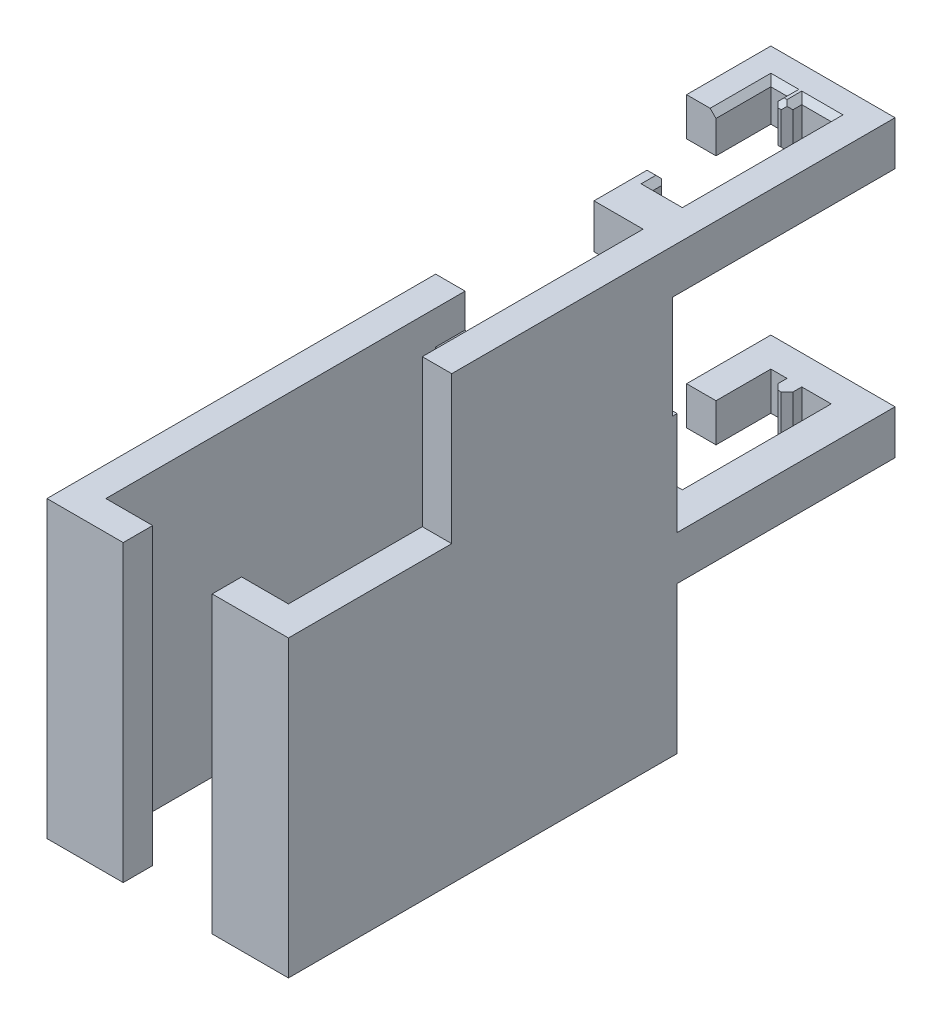
from build123d import *

# Parameters (mm, degrees)
SKETCH1_W               = 16.4
SKETCH1_H               = 26.4
SKETCH1_W_2             = 12.4
SKETCH1_H_2             = 22.4
BOSS_EXTRUDE1_DEPTH     = 20
CUT_EXTRUDE1_DEPTH      = 10
BOSS_EXTRUDE2_DEPTH     = 3
CHAMFER3_SIZE           = 0.4
SKETCH5_W               = 2
SKETCH5_H               = 14.997550085
BOSS_EXTRUDE3_DEPTH     = 10
LPATTERN1_COUNT         = 2
LPATTERN1_PITCH         = 17
CHAMFER1_SIZE           = 0.4
CHAMFER5_SIZE           = 0.4
CHAMFER6_SIZE           = 0.4
CUT_EXTRUDE2_DEPTH      = 47.301249176
CUT_EXTRUDE2_DEPTH_BACK = 47.301249176
SKETCH6_W               = 6.042108652
SKETCH6_H               = 2


with BuildPart() as part:
    # Sketch1 → Boss-Extrude1 (new body)
    with BuildSketch(Plane(origin=(0, 0, 0), x_dir=(1, 0, 0), z_dir=(0, 1, 0))):
        with Locations((6.2, 11.2)):
            Rectangle(SKETCH1_W, SKETCH1_H)
        with Locations((6.2, 11.2)):
            Rectangle(SKETCH1_W_2, SKETCH1_H_2, mode=Mode.SUBTRACT)
    extrude(amount=BOSS_EXTRUDE1_DEPTH)

    # Sketch2 → Cut-Extrude1 (cut)
    with BuildSketch(Plane(origin=(0, 0, -24.4), x_dir=(-1, 0, 0), z_dir=(0, 0, -1))):
        Polygon((-12.4, 20), (-12.4, 17.712061235), (-10.544532553, 15.856593788), (-9.258136531, 15.293507674), (-9.258136531, 13.764128217), (-8.084426715, 12.5904184), (-6.2, 11.765560038), (-4.315573285, 12.5904184), (-3.141863469, 13.764128217), (-3.141863469, 15.293507674), (-1.855467447, 15.856593788), (0, 17.712061235), (0, 20), align=None)
    extrude(amount=-CUT_EXTRUDE1_DEPTH, mode=Mode.SUBTRACT)



with BuildPart() as body_2:
    # Sketch4 → Boss-Extrude2 (new body)
    with BuildSketch(Plane(origin=(0, 30, 0), x_dir=(1, 0, 0), z_dir=(0, 1, 0))):
        Polygon((12.4, 12.2), (14.4, 12.2), (14.4, 39.19752129), (12.472658245, 39.19752129), (7.96501827, 39.19752129), (5.96501827, 39.19752129), (5.96501827, 33.473580557), (7.96501827, 33.473580557), (7.96501827, 37.19752129), (9.06501827, 37.19752129), (9.06501827, 36.19752129), (10.06501827, 36.19752129), (10.06501827, 37.19752129), (12.06501827, 37.19752129), (12.06501827, 27.08752129), (10.06501827, 27.08752129), (10.06501827, 28.08752129), (9.06501827, 28.08752129), (9.06501827, 24.08752129), (12.4, 24.08752129), align=None)
    boss_extrude2 = extrude(amount=-BOSS_EXTRUDE2_DEPTH)

    # Chamfer3
    chamfer3_edges = [body_2.edges().sort_by_distance(p)[0] for p in [
        (6.96501827, 27, -33.473580557),
        (7.96501827, 27, -35.335550923),
        (8.51501827, 27, -37.19752129),
        (9.06501827, 27, -36.69752129),
        (9.56501827, 27, -36.19752129),
        (10.06501827, 27, -36.69752129),
        (11.06501827, 27, -37.19752129),
        (9.56501827, 27, -28.08752129),
        (10.06501827, 27, -27.58752129),
        (11.06501827, 27, -27.08752129),
        (12.06501827, 27, -32.14252129),
    ]]
    chamfer(chamfer3_edges, length=CHAMFER3_SIZE)


with BuildPart() as part_1:
    add(part.part)

    add(body_2.part)  # Boss-Extrude3 merges body 2
    # Sketch5 → Boss-Extrude3 (add)
    with BuildSketch(Plane(origin=(0, 30, 0), x_dir=(1, 0, 0), z_dir=(0, 1, 0))):
        with Locations((13.4, 16.588746248)):
            Rectangle(SKETCH5_W, SKETCH5_H)
    extrude(amount=-BOSS_EXTRUDE3_DEPTH)

    # LPattern1: Boss-Extrude2 ×2
    with Locations(*[(0, -i * LPATTERN1_PITCH, 0) for i in range(1, LPATTERN1_COUNT)]):
        add(boss_extrude2)

    # Chamfer1
    chamfer1_edges = [part_1.edges().sort_by_distance(p)[0] for p in [
        (9.56501827, 30, -28.08752129),
        (10.06501827, 30, -27.58752129),
        (7.96501827, 30, -35.335550923),
        (8.51501827, 30, -37.19752129),
        (9.06501827, 30, -36.69752129),
        (9.56501827, 30, -36.19752129),
        (10.06501827, 30, -36.69752129),
        (11.06501827, 30, -27.08752129),
        (11.06501827, 30, -37.19752129),
        (12.06501827, 30, -32.14252129),
    ]]
    chamfer(chamfer1_edges, length=CHAMFER1_SIZE)

    # Chamfer5
    chamfer5_edges = [part_1.edges().sort_by_distance(p)[0] for p in [
        (6.96501827, 10, -33.473580557),
        (7.96501827, 10, -35.335550923),
        (8.51501827, 10, -37.19752129),
        (9.06501827, 10, -36.69752129),
        (9.56501827, 10, -36.19752129),
        (10.06501827, 10, -36.69752129),
        (11.06501827, 10, -37.19752129),
        (12.06501827, 10, -32.14252129),
        (11.06501827, 10, -27.08752129),
    ]]
    chamfer(chamfer5_edges, length=CHAMFER5_SIZE)

    # Chamfer6
    chamfer6_edges = [part_1.edges().sort_by_distance(p)[0] for p in [
        (9.06501827, 28.5, -28.08752129),
        (10.06501827, 28.5, -28.08752129),
        (10.06501827, 28.5, -36.19752129),
        (9.06501827, 28.5, -36.19752129),
        (10.06501827, 11.7, -36.19752129),
        (9.06501827, 11.7, -36.19752129),
        (9.06501827, 11.5, -28.08752129),
    ]]
    chamfer(chamfer6_edges, length=CHAMFER6_SIZE)

    # Sketch6 → Cut-Extrude2 (cut, two sides: drawn at the far end of the back side and taken through both)
    with BuildSketch(Plane(origin=(0, 20, 0), x_dir=(1, 0, 0), z_dir=(0, 1, 0)).offset(-CUT_EXTRUDE2_DEPTH_BACK)):
        with Locations((6.2, -1)):
            Rectangle(SKETCH6_W, SKETCH6_H)
    extrude(amount=CUT_EXTRUDE2_DEPTH + CUT_EXTRUDE2_DEPTH_BACK, mode=Mode.SUBTRACT)


solid = part_1.part
